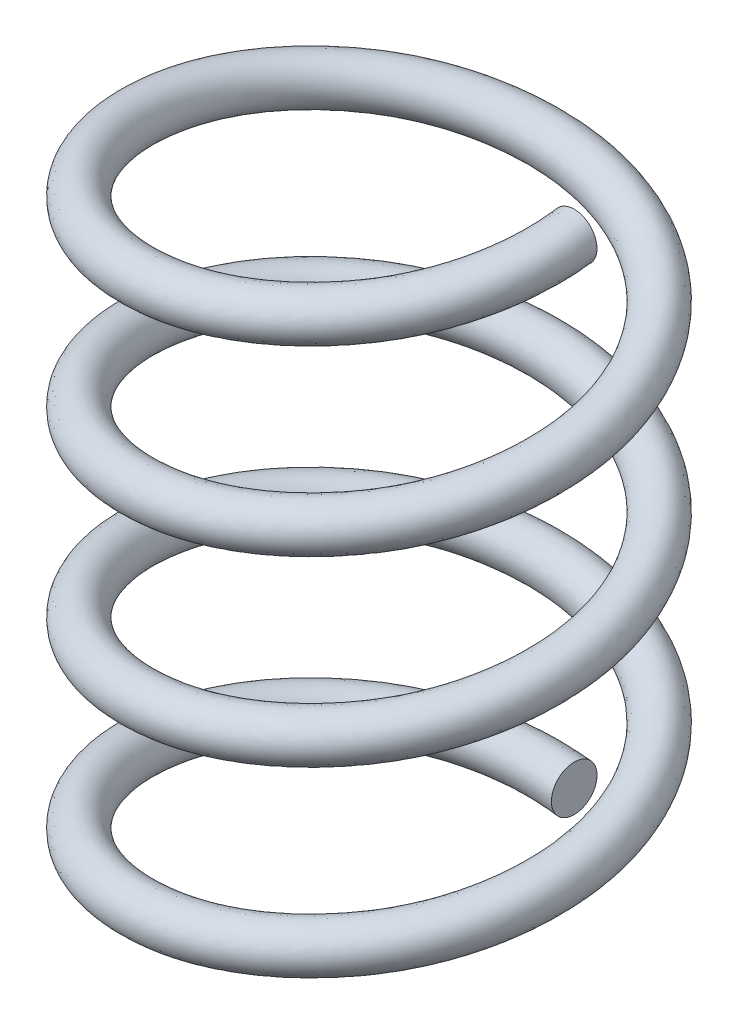
from build123d import *

# Parameters (mm, degrees)
SPRING_PITCH          = 1.6
SPRING_HEIGHT         = 6
SPRING_RADIUS         = 1.8
SPRING_START_ANGLE    = 90
SPRINGBODYDIAMETERS_R = 0.2


with BuildPart() as part:
    # SPRING: sweep along a helix
    with BuildLine() as spring_path:
        add(Helix(SPRING_PITCH, SPRING_HEIGHT, SPRING_RADIUS, center=(0, 0, 0), direction=(0, -1, 0), mode=Mode.PRIVATE).rotate(Axis((0, 0, 0), (0, -1, 0)), SPRING_START_ANGLE))
    # SpringBodyDiameterS → SPRING (sweep)
    with BuildSketch(Plane.XY):
        with Locations((1.8, 0)):
            Circle(SPRINGBODYDIAMETERS_R)
    sweep(path=spring_path.line, is_frenet=True)


solid = part.part
